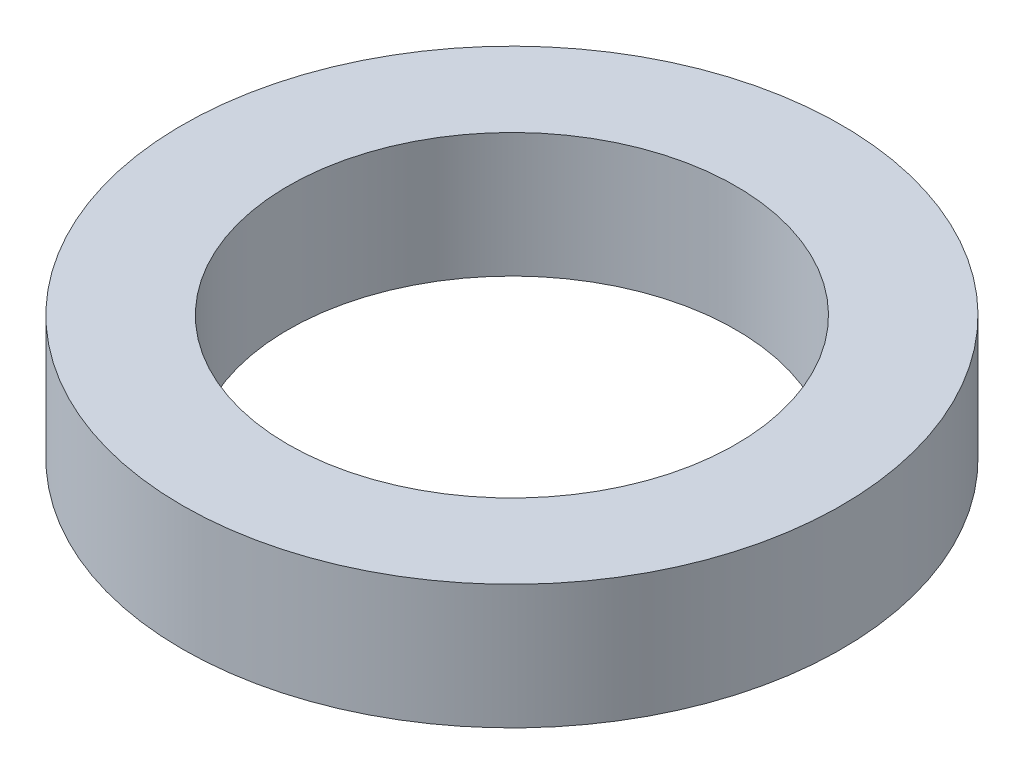
from build123d import *

# Parameters (mm, degrees)
SKETCH1_R           = 6.731
SKETCH1_R_2         = 4.572
BOSS_EXTRUDE1_DEPTH = 2.54


with BuildPart() as part:
    # Sketch1 → Boss-Extrude1 (new body)
    with BuildSketch(Plane(origin=(0, 0, 0), x_dir=(1, 0, 0), z_dir=(0, 1, 0))):
        with Locations(Location((0, 0, 0), (0, 0, 270))):
            Circle(SKETCH1_R)
        with Locations(Location((0, 0, 0), (0, 0, 270))):
            Circle(SKETCH1_R_2, mode=Mode.SUBTRACT)
    extrude(amount=BOSS_EXTRUDE1_DEPTH)


solid = part.part
